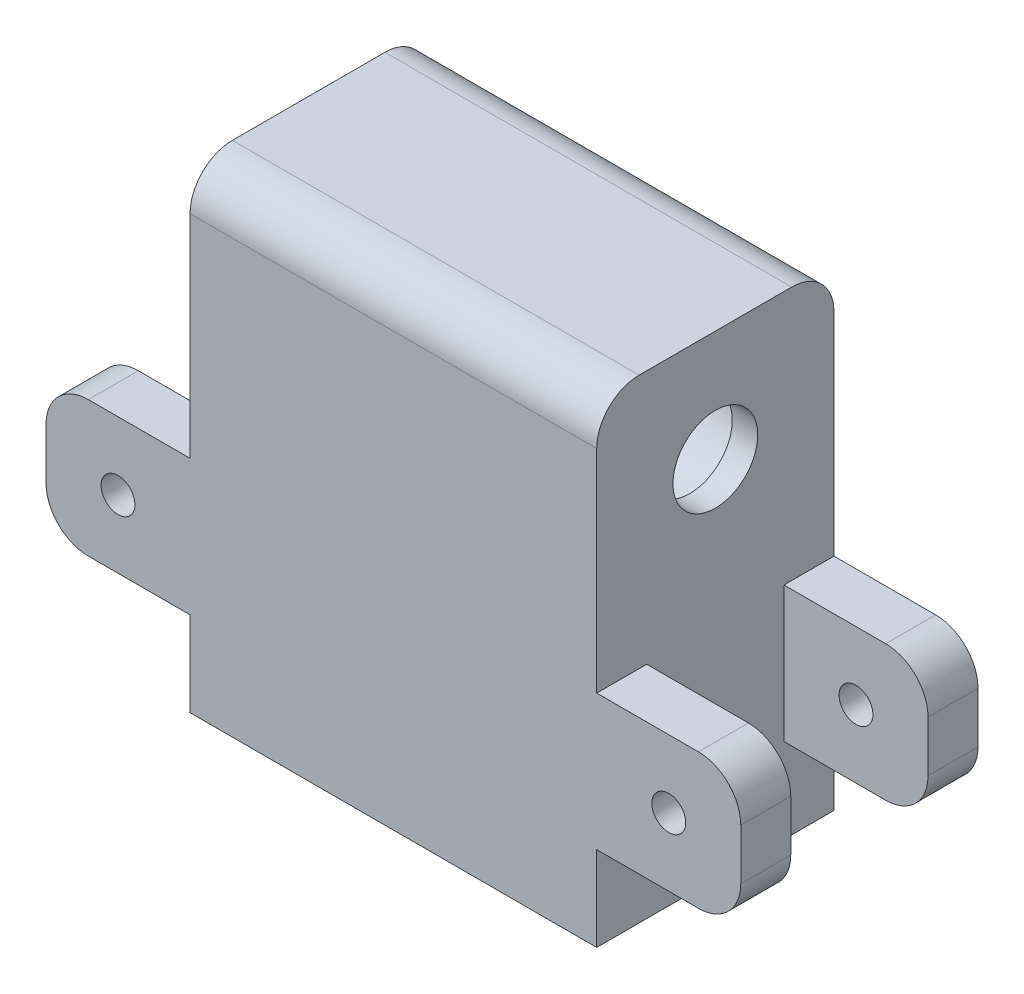
from build123d import *

# Parameters (mm, degrees)
SKETCH1_W            = 48
SKETCH1_H            = 28
BOSS_EXTRUDE1_DEPTH  = 56
SKETCH2_W            = 5.9
SKETCH2_H            = 16
BOSS_EXTRUDE3_DEPTH  = 17
SKETCH1_5_R          = 4
CUT_EXTRUDE2_DEPTH   = 30
FILLET1_R            = 5
SKETCH6_R            = 2
CUT_EXTRUDE3_DEPTH   = 3
SKETCH6_2_R          = 2
CUT_EXTRUDE4_DEPTH   = 35
FILLET1_OF_MIRROR1_R = 5
SKETCH7_R            = 5
CUT_EXTRUDE5_DEPTH   = 52
SKETCH7_3_R          = 7.6
CUT_EXTRUDE6_DEPTH   = 45
FILLET2_R            = 5
CUT_EXTRUDE7_DEPTH   = 6.5
SKETCH8_3_R          = 1
CUT_EXTRUDE8_DEPTH   = 10
SKETCH10_R           = 1.25
CUT_EXTRUDE12_DEPTH  = 18


with BuildPart() as part:
    # Sketch1 → Boss-Extrude1 (new body)
    with BuildSketch(Plane(origin=(0, 0, 0), x_dir=(1, 0, 0), z_dir=(0, 1, 0))):
        Rectangle(SKETCH1_W, SKETCH1_H)
    extrude(amount=BOSS_EXTRUDE1_DEPTH)

    # Sketch2 → Boss-Extrude3 (add)
    with BuildSketch(Plane(origin=(24, 0, 0), x_dir=(0, 0, -1), z_dir=(1, 0, 0))):
        with Locations((-11.05, 18)):
            Rectangle(SKETCH2_W, SKETCH2_H)
        with Locations((11.05, 18)):
            Rectangle(SKETCH2_W, SKETCH2_H)
    boss_extrude3 = extrude(amount=BOSS_EXTRUDE3_DEPTH)

    # Sketch1<5> → Cut-Extrude2 (cut)
    with BuildSketch(Plane(origin=(0, 0, 0), x_dir=(1, 0, 0), z_dir=(0, 1, 0))):
        with Locations(Location((-15, 0, 0), (0, 0, 270))):
            Circle(SKETCH1_5_R)
        with Locations(Location((15, 0, 0), (0, 0, 270))):
            Circle(SKETCH1_5_R)
    extrude(amount=CUT_EXTRUDE2_DEPTH, mode=Mode.SUBTRACT)

    # Fillet1
    fillet1_edges = [part.edges().sort_by_distance(p)[0] for p in [
        (41, 26, 11.05),
        (41, 10, 11.05),
        (41, 10, -11.05),
        (41, 26, -11.05),
    ]]
    fillet(fillet1_edges, radius=FILLET1_R)

    # Sketch6 → Cut-Extrude3 (cut)
    with BuildSketch(Plane(origin=(0, 0, -14), x_dir=(-1, 0, 0), z_dir=(0, 0, -1))):
        Polygon((-32.5, 22.041451884), (-36, 20.020725942), (-36, 15.979274058), (-32.5, 13.958548116), (-29, 15.979274058), (-29, 20.020725942), align=None)
        with Locations((-32.5, 18)):
            Circle(SKETCH6_R, mode=Mode.SUBTRACT)
    cut_extrude3 = extrude(amount=-CUT_EXTRUDE3_DEPTH, mode=Mode.SUBTRACT)

    # Sketch6<2> → Cut-Extrude4 (cut)
    with BuildSketch(Plane(origin=(0, 0, -14), x_dir=(-1, 0, 0), z_dir=(0, 0, -1))):
        with Locations((-32.5, 18)):
            Circle(SKETCH6_2_R)
    cut_extrude4 = extrude(amount=-CUT_EXTRUDE4_DEPTH, mode=Mode.SUBTRACT)

    # Mirror1: Boss-Extrude3, Cut-Extrude3, Cut-Extrude4 across plane
    add(boss_extrude3.mirror(Plane(origin=(0, 0, 0), x_dir=(0, 0, 1), z_dir=(1, 0, 0))))
    add(cut_extrude3.mirror(Plane(origin=(0, 0, 0), x_dir=(0, 0, 1), z_dir=(1, 0, 0))), mode=Mode.SUBTRACT)
    add(cut_extrude4.mirror(Plane(origin=(0, 0, 0), x_dir=(0, 0, 1), z_dir=(1, 0, 0))), mode=Mode.SUBTRACT)

    # Fillet1 of Mirror1
    fillet1_of_mirror1_edges = [part.edges().sort_by_distance(p)[0] for p in [
        (-41, 26, 11.05),
        (-41, 10, 11.05),
        (-41, 10, -11.05),
        (-41, 26, -11.05),
    ]]
    fillet(fillet1_of_mirror1_edges, radius=FILLET1_OF_MIRROR1_R)

    # Sketch7 → Cut-Extrude5 (cut)
    with BuildSketch(Plane.ZY.offset(24)):
        with Locations((0, 42.9)):
            Circle(SKETCH7_R)
    extrude(amount=-CUT_EXTRUDE5_DEPTH, mode=Mode.SUBTRACT)

    # Sketch7<3> → Cut-Extrude6 (cut)
    with BuildSketch(Plane.ZY.offset(24)):
        with Locations((0, 42.9)):
            Circle(SKETCH7_3_R)
    extrude(amount=-CUT_EXTRUDE6_DEPTH, mode=Mode.SUBTRACT)

    # Fillet2
    fillet2_edges = [part.edges().sort_by_distance(p)[0] for p in [
        (0, 56, -14),
        (0, 56, 14),
    ]]
    fillet(fillet2_edges, radius=FILLET2_R)

    # Sketch8 → Cut-Extrude7 (cut)
    with BuildSketch(Plane(origin=(0, 0, -14), x_dir=(-1, 0, 0), z_dir=(0, 0, -1))):
        Polygon((-1, 15.5), (-1, 10.5), (-7, 10.5), (-7, 15.5), (-9, 15.5), (-9, 10.5), (-10, 10.5), (-10, 0), (10, 0), (10, 10.5), (9, 10.5), (9, 15.5), (7, 15.5), (7, 10.5), (1, 10.5), (1, 15.5), align=None)
    extrude(amount=-CUT_EXTRUDE7_DEPTH, mode=Mode.SUBTRACT)

    # Sketch8<3> → Cut-Extrude8 (cut)
    with BuildSketch(Plane(origin=(0, 0, -14), x_dir=(-1, 0, 0), z_dir=(0, 0, -1))):
        with Locations((4.75, 7.3)):
            Circle(SKETCH8_3_R)
        with Locations((-4.75, 7.3)):
            Circle(SKETCH8_3_R)
    extrude(amount=-CUT_EXTRUDE8_DEPTH, mode=Mode.SUBTRACT)

    # Sketch10 → Cut-Extrude12 (cut)
    with BuildSketch(Plane(origin=(0, 0, -14), x_dir=(-1, 0, 0), z_dir=(0, 0, -1))):
        with Locations((-15, 30)):
            Circle(SKETCH10_R)
        with Locations((15, 30)):
            Circle(SKETCH10_R)
    extrude(amount=-CUT_EXTRUDE12_DEPTH, mode=Mode.SUBTRACT)


solid = part.part
